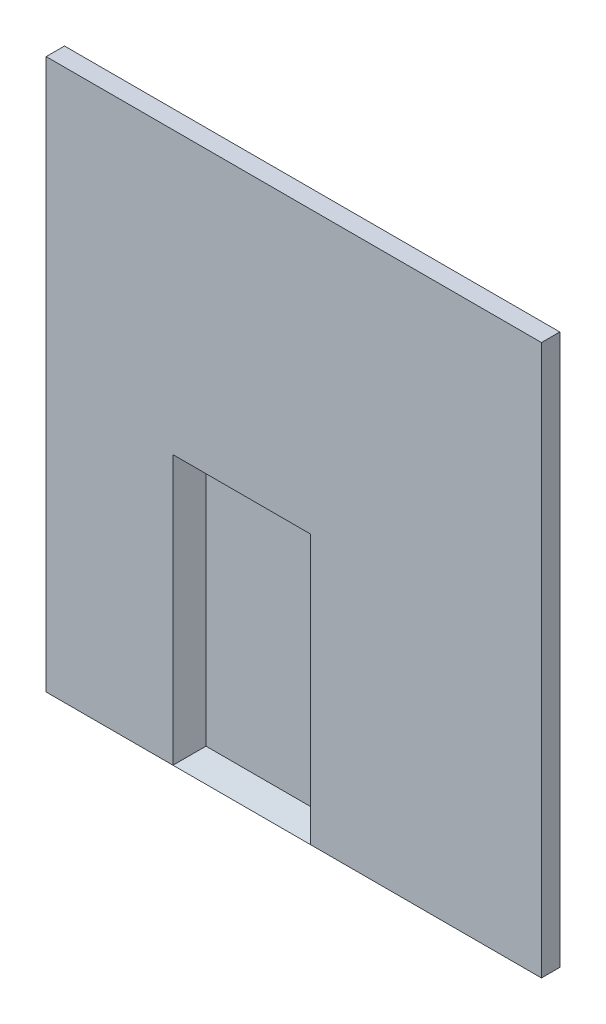
from build123d import *

# Parameters (mm, degrees)
SKETCH1_W           = 270
SKETCH1_H           = 300
BOSS_EXTRUDE1_DEPTH = 10
SKETCH2_W           = 75
SKETCH2_H           = 146.65
CUT_EXTRUDE1_DEPTH  = 9
CUT_EXTRUDE1_DRAFT  = -45


with BuildPart() as part:
    # Sketch1 → Boss-Extrude1 (new body)
    with BuildSketch(Plane.XY):
        Rectangle(SKETCH1_W, SKETCH1_H)
    extrude(amount=BOSS_EXTRUDE1_DEPTH)


with BuildPart() as cut_extrude1_tool:
    # Sketch2 → Cut-Extrude1 (with draft: the straight prism first)
    with BuildSketch(Plane.XY.offset(10)):
        with Locations((-28.39, -76.675)):
            Rectangle(SKETCH2_W, SKETCH2_H)
    extrude(amount=-CUT_EXTRUDE1_DEPTH)
    # Cut-Extrude1: the draft: its side faces are tilted about the plane it starts from
    cut_extrude1_sides = [cut_extrude1_tool.faces().sort_by_distance(p)[0] for p in [
        (-28.39, -150, 5.5),
        (9.11, -76.675, 5.5),
        (-28.39, -3.35, 5.5),
        (-65.89, -76.675, 5.5),
    ]]
    draft(cut_extrude1_sides, Plane.XY.offset(10), CUT_EXTRUDE1_DRAFT)


with BuildPart() as part_1:
    add(part.part)

    # Cut-Extrude1: cut by cut_extrude1_tool
    add(cut_extrude1_tool.part, mode=Mode.SUBTRACT)


solid = part_1.part
